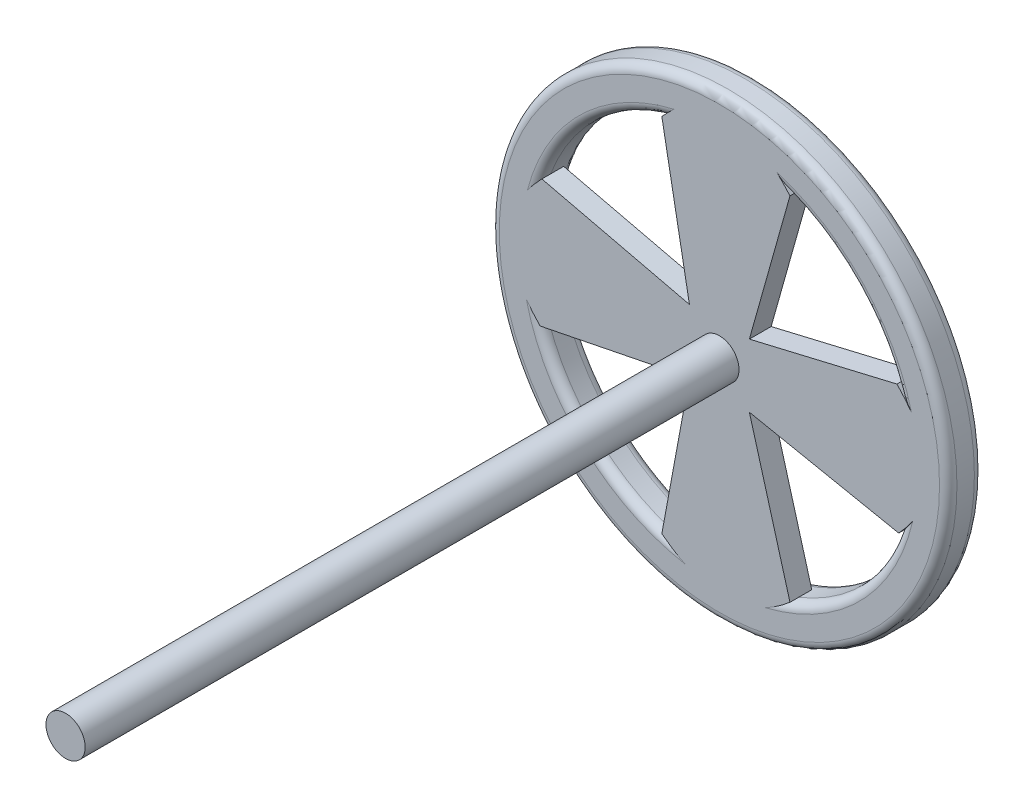
from build123d import *

# Parameters (mm, degrees)
SKETCH1_R           = 133.35
SKETCH1_R_2         = 110.49
BOSS_EXTRUDE1_DEPTH = 20.32
FILLET1_R           = 5.08
FILLET4_R           = 5.08
FILLET5_R           = 5.08
FILLET6_R           = 5.08
SKETCH2_R           = 25.4
BOSS_EXTRUDE2_DEPTH = 12.7
SKETCH3_R           = 11.43
BOSS_EXTRUDE3_DEPTH = 381


with BuildPart() as part:
    # Sketch1 → Boss-Extrude1 (new body)
    with BuildSketch(Plane.XY):
        Circle(SKETCH1_R)
        Circle(SKETCH1_R_2, mode=Mode.SUBTRACT)
    extrude(amount=BOSS_EXTRUDE1_DEPTH)

    # Fillet1
    fillet1_edges = [part.edges().sort_by_distance(p)[0] for p in [
        (-133.35, 0, 20.32),
    ]]
    fillet(fillet1_edges, radius=FILLET1_R)

    # Fillet4
    fillet4_edges = [part.edges().sort_by_distance(p)[0] for p in [
        (-133.35, 0, 0),
    ]]
    fillet(fillet4_edges, radius=FILLET4_R)

    # Fillet5
    fillet5_edges = [part.edges().sort_by_distance(p)[0] for p in [
        (-110.49, 0, 20.32),
    ]]
    fillet(fillet5_edges, radius=FILLET5_R)

    # Fillet6
    fillet6_edges = [part.edges().sort_by_distance(p)[0] for p in [
        (-110.49, 0, 0),
    ]]
    fillet(fillet6_edges, radius=FILLET6_R)



with BuildPart() as body_2:
    # Sketch2 → Boss-Extrude2 (new body)
    with BuildSketch(Plane.XY.offset(20.32)):
        with BuildLine():
            add(Edge.make_bspline(
                [(111.995773379, 28.519671196), (108.395461325, 33.640925655), (103.465758881, 38.766955506)],
                knots=[0.86323948, 0.86323948, 0.86323948, 1, 1, 1], degree=2))
            Line((103.465758881, 38.766955506), (17.465361403, 18.442373791))
            ThreePointArc((17.465361403, 18.442373791), (23.332168562, 10.038421698), (25.4, 0))
            ThreePointArc((25.4, 0), (23.332168562, -10.038421698), (17.465361403, -18.442373791))
            Line((17.465361403, -18.442373791), (104.480917214, -35.941313806))
            add(Edge.make_bspline(
                [(104.480917214, -35.941313806), (109.199570697, -30.926942984), (112.628608991, -25.907939648)],
                knots=[0, 0, 0, 0.134699054, 0.134699054, 0.134699054], degree=2))
            ThreePointArc((112.628608991, -25.907939648), (114.832297811, -13.037188327), (115.57, 0))
            ThreePointArc((115.57, 0), (114.672962004, 14.37138425), (111.995773379, 28.519671196))
        make_face()
        with BuildLine():
            ThreePointArc((-17.465361403, 18.442373791), (0, 25.4), (17.465361403, 18.442373791))
            Line((17.465361403, 18.442373791), (41.120888712, 102.55297466))
            add(Edge.make_bspline(
                [(33.408134269, 110.6359863), (37.257292789, 107.035833442), (41.120888712, 102.55297466)],
                knots=[0.898413925, 0.898413925, 0.898413925, 1, 1, 1], degree=2))
            ThreePointArc((33.408134269, 110.6359863), (3.618968694, 115.513323758), (-26.417084957, 112.510277408))
            add(Edge.make_bspline(
                [(-33.5455644, 105.274570572), (-29.987921782, 109.295772293), (-26.417084957, 112.510277408)],
                knots=[0, 0, 0, 0.097113874, 0.097113874, 0.097113874], degree=2))
            Line((-33.5455644, 105.274570572), (-17.465361403, 18.442373791))
        make_face()
        with BuildLine():
            Line((41.120888883, -102.552974591), (17.465361403, -18.442373791))
            ThreePointArc((17.465361403, -18.442373791), (0, -25.4), (-17.465361403, -18.442373791))
            Line((-17.465361403, -18.442373791), (-33.545564575, -105.274570516))
            add(Edge.make_bspline(
                [(-33.545564575, -105.274570516), (-26.738144431, -110.571915765), (-19.922448027, -113.839891798)],
                knots=[0, 0, 0, 0.182948004, 0.182948004, 0.182948004], degree=2))
            ThreePointArc((-19.922448027, -113.839891798), (3.568860133, -115.514882753), (26.911965601, -112.392931306))
            add(Edge.make_bspline(
                [(26.911965601, -112.392931306), (34.011973832, -108.564945177), (41.120888883, -102.552974591)],
                knots=[0.810210618, 0.810210618, 0.810210618, 1, 1, 1], degree=2))
        make_face()
        with BuildLine():
            ThreePointArc((-17.465361403, -18.442373791), (-25.4, 0), (-17.465361403, 18.442373791))
            Line((-17.465361403, 18.442373791), (-103.453712161, 38.799092001))
            add(Edge.make_bspline(
                [(-111.872978372, 28.997613871), (-108.286344087, 33.895850119), (-103.453712161, 38.799092001)],
                knots=[0.869248391, 0.869248391, 0.869248391, 1, 1, 1], degree=2))
            ThreePointArc((-111.872978372, 28.997613871), (-115.56181287, 1.375611191), (-112.531537583, -26.326373643))
            add(Edge.make_bspline(
                [(-104.492035357, -35.908977246), (-109.115451856, -31.120100592), (-112.531537583, -26.326373643)],
                knots=[0, 0, 0, 0.128706822, 0.128706822, 0.128706822], degree=2))
            Line((-104.492035357, -35.908977246), (-17.465361403, -18.442373791))
        make_face()
        Circle(SKETCH2_R)
    extrude(amount=-BOSS_EXTRUDE2_DEPTH)


with BuildPart() as part_1:
    add(part.part)

    add(body_2.part)  # Boss-Extrude3 merges body 2
    # Sketch3 → Boss-Extrude3 (add)
    with BuildSketch(Plane.XY.offset(20.32)):
        Circle(SKETCH3_R)
    extrude(amount=BOSS_EXTRUDE3_DEPTH)


solid = part_1.part
